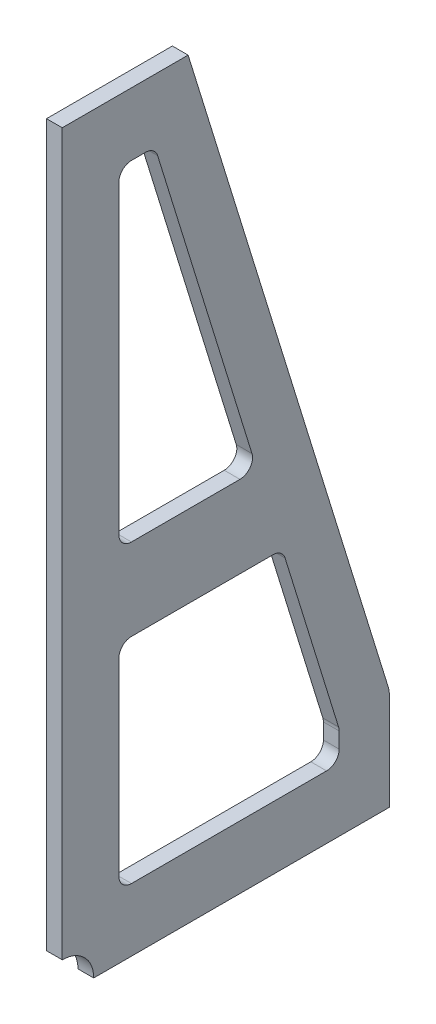
from build123d import *

# Parameters (mm, degrees)
BOSS_EXTRUDE1_DEPTH = 25
CUT_EXTRUDE1_REACH  = 1305.476


with BuildPart() as part:
    # Sketch1 → Boss-Extrude1 (new body)
    with BuildSketch(Plane(origin=(0, 0, 0), x_dir=(0, 0, -1), z_dir=(1, 0, 0))):
        with BuildLine():
            Line((0, 50), (0, 1195))
            Line((0, 1195), (200, 1195))
            Line((200, 1195), (517.768948114, 167.216058445))
            ThreePointArc((517.768948114, 167.216058445), (519.439090838, 159.915268109), (520, 152.446915067))
            Line((520, 152.446915067), (520, 0))
            Line((520, 0), (50, 0))
            ThreePointArc((50, 0), (35.355339059, 35.355339059), (0, 50))
        make_face()
    extrude(amount=-BOSS_EXTRUDE1_DEPTH)

    # Sketch2 → Cut-Extrude1 (cut, up to next)
    with BuildSketch(Plane(origin=(0, 0, 0), x_dir=(0, 0, -1), z_dir=(1, 0, 0)), mode=Mode.PRIVATE) as cut_extrude1_sk1:
        with BuildLine():
            Line((90, 120), (90, 420))
            ThreePointArc((90, 420), (95.857864376, 434.142135624), (110, 440))
            Line((110, 440), (334.943019945, 440))
            ThreePointArc((334.943019945, 440), (346.814137267, 436.095855787), (354.05059919, 425.907657351))
            Line((354.05059919, 425.907657351), (439.107579245, 150.801487485))
            ThreePointArc((439.107579245, 150.801487485), (439.775636335, 147.881171351), (440, 144.893830134))
            Line((440, 144.893830134), (440, 120))
            ThreePointArc((440, 120), (434.142135624, 105.857864376), (420, 100))
            Line((420, 100), (110, 100))
            ThreePointArc((110, 100), (95.857864376, 105.857864376), (90, 120))
        make_face()
    cut_extrude1_tool1 = extrude(cut_extrude1_sk1.sketch, amount=-CUT_EXTRUDE1_REACH, mode=Mode.PRIVATE) & part.part
    # Sketch2 → Cut-Extrude1 (cut, up to next)
    with BuildSketch(Plane(origin=(0, 0, 0), x_dir=(0, 0, -1), z_dir=(1, 0, 0)), mode=Mode.PRIVATE) as cut_extrude1_sk2:
        with BuildLine():
            Line((90, 590), (90, 1075))
            ThreePointArc((90, 1075), (95.857864376, 1089.142135624), (110, 1095))
            Line((110, 1095), (132.43094265, 1095))
            ThreePointArc((132.43094265, 1095), (144.302059973, 1091.095855787), (151.538521896, 1080.907657351))
            Line((151.538521896, 1080.907657351), (301.490212717, 595.907657351))
            ThreePointArc((301.490212717, 595.907657351), (298.478489258, 578.128882677), (282.382633471, 570))
            Line((282.382633471, 570), (110, 570))
            ThreePointArc((110, 570), (95.857864376, 575.857864376), (90, 590))
        make_face()
    cut_extrude1_tool2 = extrude(cut_extrude1_sk2.sketch, amount=-CUT_EXTRUDE1_REACH, mode=Mode.PRIVATE) & part.part
    add(cut_extrude1_tool1.solids().sort_by_distance((0, 260.991144, -246.99454))[0], mode=Mode.SUBTRACT)
    add(cut_extrude1_tool2.solids().sort_by_distance((0, 781.346957, -166.978745))[0], mode=Mode.SUBTRACT)


solid = part.part
